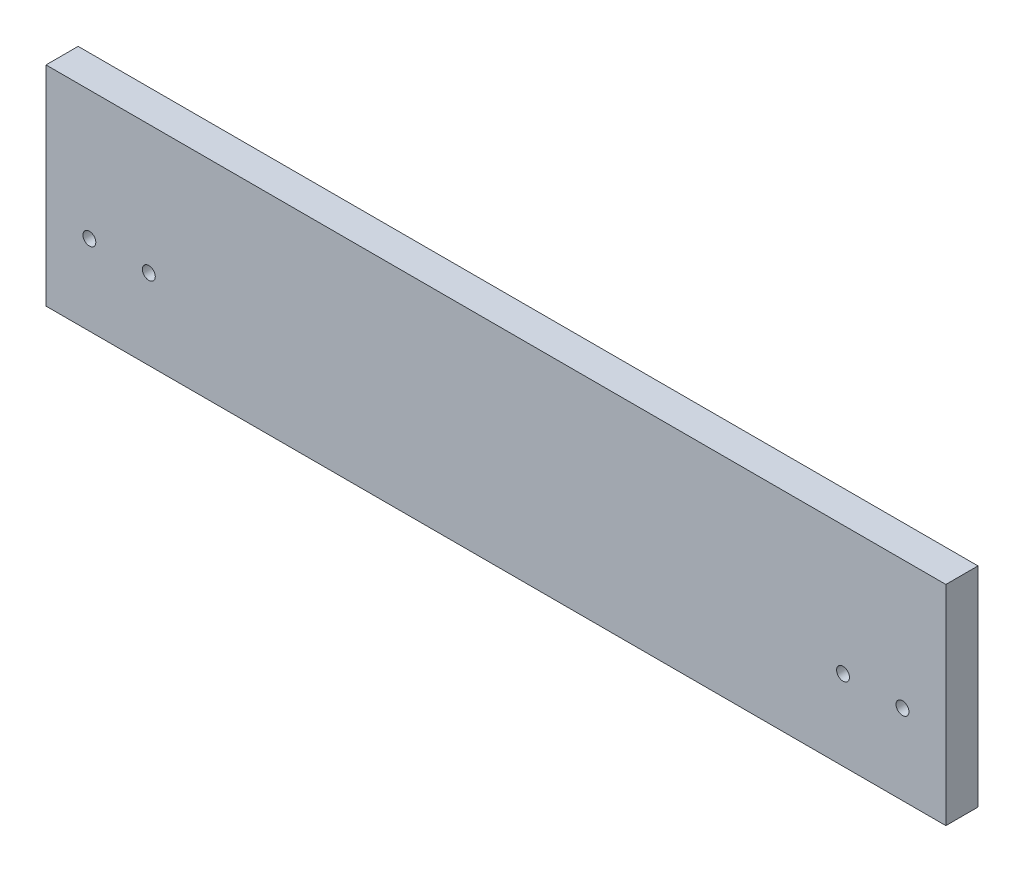
from build123d import *

# Parameters (mm, degrees)
SCHIZZO1_W                   = 280
SCHIZZO1_H                   = 65
ESTRUSIONE_ESTRUSIONE1_DEPTH = 10
SCHIZZO2_R                   = 2
TAGLIO_ESTRUSIONE1_DEPTH     = 10


with BuildPart() as part:
    # Schizzo1 → Estrusione-Estrusione1 (new body)
    with BuildSketch(Plane.XY):
        with Locations((-140, 32.5)):
            Rectangle(SCHIZZO1_W, SCHIZZO1_H)
    extrude(amount=ESTRUSIONE_ESTRUSIONE1_DEPTH)

    # Schizzo2 → Taglio-Estrusione1 (cut)
    with BuildSketch(Plane(origin=(0, 0, 0), x_dir=(-1, 0, 0), z_dir=(0, 0, -1))):
        with Locations((248, 24.933694222)):
            Circle(SCHIZZO2_R)
        with Locations((266.5, 24.933694222)):
            Circle(SCHIZZO2_R)
        with Locations((13.5, 24.933694222)):
            Circle(SCHIZZO2_R)
        with Locations((32, 24.933694222)):
            Circle(SCHIZZO2_R)
    extrude(amount=-TAGLIO_ESTRUSIONE1_DEPTH, mode=Mode.SUBTRACT)


solid = part.part
